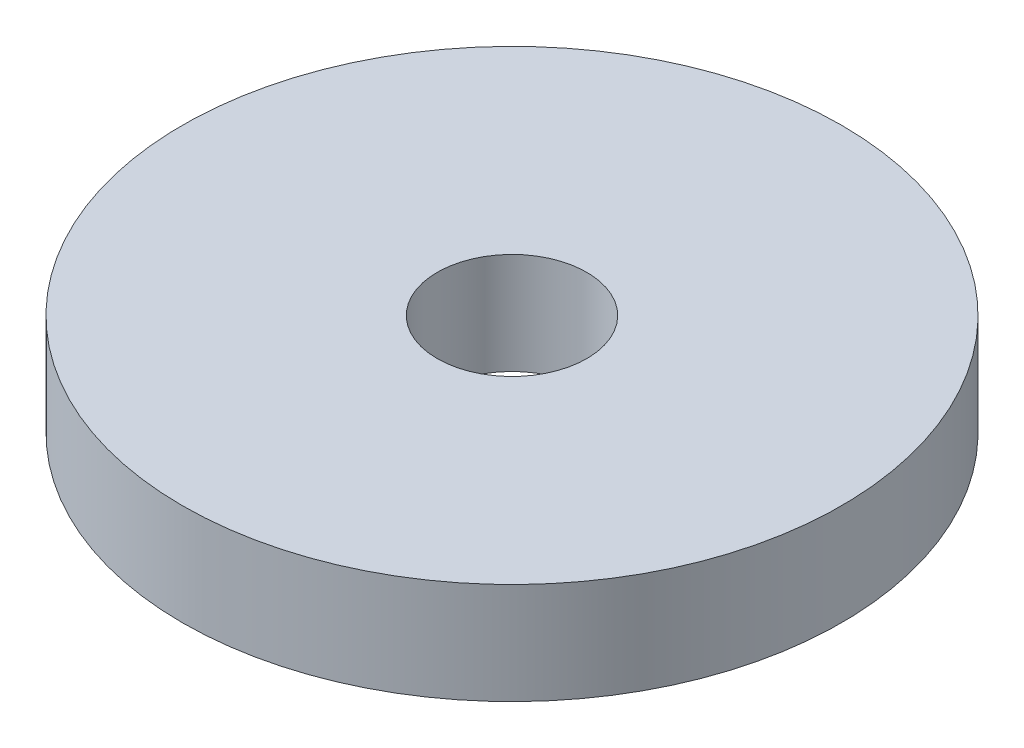
from build123d import *

# Parameters (mm, degrees)
SKETCH1_R           = 6.5
SKETCH1_R_2         = 1.475
BOSS_EXTRUDE1_DEPTH = 2


with BuildPart() as part:
    # Sketch1 → Boss-Extrude1 (new body)
    with BuildSketch(Plane(origin=(0, 0, 0), x_dir=(1, 0, 0), z_dir=(0, 1, 0))):
        with Locations(Location((0, 0, 0), (0, 0, 270))):
            Circle(SKETCH1_R)
        with Locations(Location((0, 0, 0), (0, 0, 270))):
            Circle(SKETCH1_R_2, mode=Mode.SUBTRACT)
    extrude(amount=BOSS_EXTRUDE1_DEPTH)


solid = part.part
